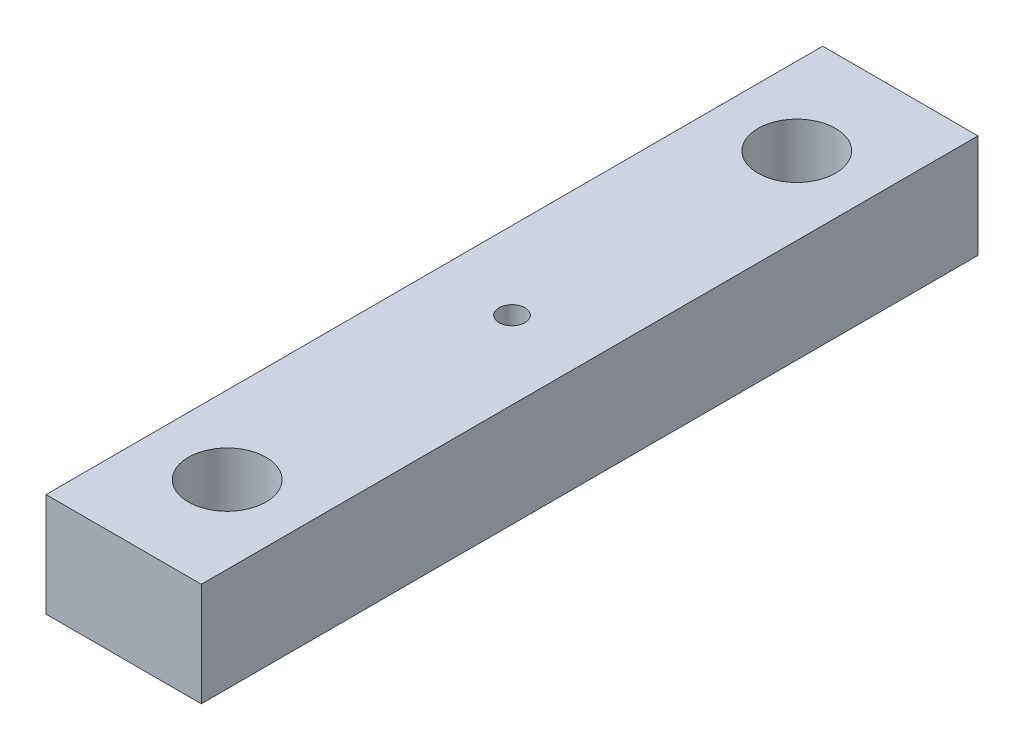
from build123d import *

# Parameters (mm, degrees)
SKETCH1_W           = 30
SKETCH1_H           = 150
SKETCH1_R           = 7.5
SKETCH1_R_2         = 2.5
BOSS_EXTRUDE1_DEPTH = 20


with BuildPart() as part:
    # Sketch1 → Boss-Extrude1 (new body)
    with BuildSketch(Plane(origin=(0, 0, 0), x_dir=(1, 0, 0), z_dir=(0, 1, 0))):
        Rectangle(SKETCH1_W, SKETCH1_H)
        with Locations(Location((0, 55, 0), (0, 0, 270))):
            Circle(SKETCH1_R, mode=Mode.SUBTRACT)
        with Locations(Location((0, -55, 0), (0, 0, 90))):
            Circle(SKETCH1_R, mode=Mode.SUBTRACT)
        with Locations(Location((0, 0, 0), (0, 0, 270))):
            Circle(SKETCH1_R_2, mode=Mode.SUBTRACT)
    extrude(amount=BOSS_EXTRUDE1_DEPTH)


solid = part.part
